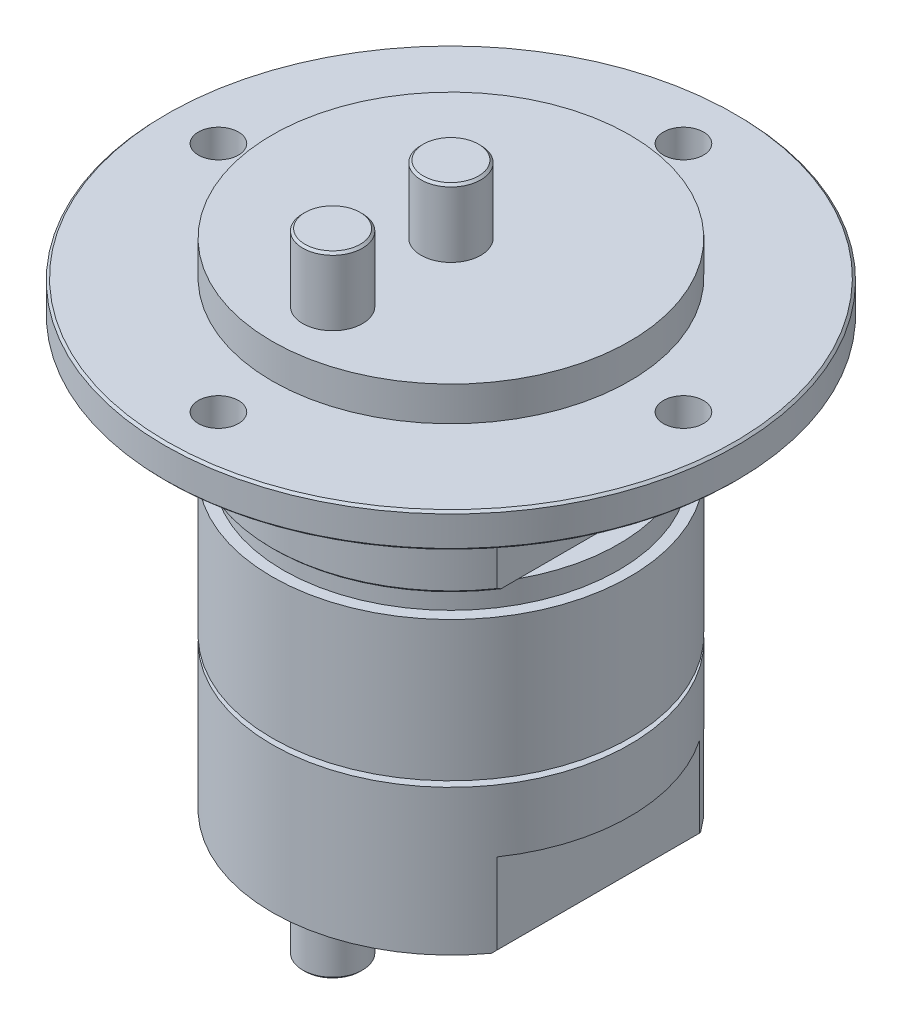
from build123d import *

# Parameters (mm, degrees)
BOSS_EXTRUDE1_DEPTH      = 6
BOSS_EXTRUDE1_DEPTH_BACK = 49.9
SKETCH2_R                = 2.65
SKETCH3_R                = 1.78
CUT_EXTRUDE1_DEPTH       = 6
SKETCH4_W                = 5.711822604
SKETCH4_H                = 7.4
CUT_EXTRUDE2_DEPTH       = 60.035942442
CHAMFER1_SIZE            = 0.2


with BuildPart() as part:
    # Sketch1 → Revolve1 (revolve)
    with BuildSketch(Plane.XY, mode=Mode.PRIVATE) as revolve1_sk:
        Polygon((0, 3.05), (-15.875, 3.05), (-15.875, 0), (-25.4, 0), (-25.4, -3.05), (-15.875, -3.05), (-15.875, -13.05), (-14.875, -13.05), (-14.875, -15.05), (-15.875, -15.05), (-15.875, -27.45), (-14.875, -27.45), (-14.875, -27.95), (-15.875, -27.95), (-15.875, -40.85), (0, -40.85), align=None)
    revolve(revolve1_sk.sketch.rotate(Axis((0, 50.719281348, 0), (0, -1, 0)), 270), axis=Axis((0, 50.719281348, 0), (0, -1, 0)))

    # Sketch2 → Boss-Extrude1 (add, two sides: drawn at the far end of the back side and taken through both)
    with BuildSketch(Plane(origin=(0, 3.05, 0), x_dir=(1, 0, 0), z_dir=(0, 1, 0)).offset(-BOSS_EXTRUDE1_DEPTH_BACK)):
        with Locations(Location((0, 0, 0), (0, 0, 270))):
            Circle(SKETCH2_R)
        with Locations(Location((0, -10.5, 0), (0, 0, 270))):
            Circle(SKETCH2_R)
    extrude(amount=BOSS_EXTRUDE1_DEPTH + BOSS_EXTRUDE1_DEPTH_BACK)

    # Sketch3 → Cut-Extrude1 (cut)
    with BuildSketch(Plane(origin=(0, 0, 0), x_dir=(1, 0, 0), z_dir=(0, 1, 0))):
        with Locations(Location((0, 20.64, 0), (0, 0, 270))):
            Circle(SKETCH3_R)
        with Locations(Location((-20.64, 0, 0), (0, 0, 270))):
            Circle(SKETCH3_R)
        with Locations(Location((0, -20.64, 0), (0, 0, 270))):
            Circle(SKETCH3_R)
        with Locations(Location((20.64, 0, 0), (0, 0, 270))):
            Circle(SKETCH3_R)
    extrude(amount=-CUT_EXTRUDE1_DEPTH, mode=Mode.SUBTRACT)

    # Sketch4 → Cut-Extrude2 (cut, symmetric)
    with BuildSketch(Plane.XY):
        with Locations((-15.935911302, -9.35)):
            Rectangle(SKETCH4_W, SKETCH4_H)
        with Locations((-15.935911302, -37.184964336)):
            Rectangle(SKETCH4_W, SKETCH4_H)
    cut_extrude2 = extrude(amount=CUT_EXTRUDE2_DEPTH, both=True, mode=Mode.SUBTRACT)

    # Mirror1: Cut-Extrude2 across plane
    add(cut_extrude2.mirror(Plane(origin=(0, 0, 0), x_dir=(0, 0, 1), z_dir=(1, 0, 0))), mode=Mode.SUBTRACT)

    # Chamfer1
    chamfer1_edges = [part.edges().sort_by_distance(p)[0] for p in [
        (13.08, -40.85, 0),
        (0, -13.05, -15.875),
        (0, -3.05, -25.4),
        (0, 0, -25.4),
        (0, -46.85, -2.65),
        (0, 9.05, -2.65),
        (0, -46.85, 7.85),
        (0, 9.05, 7.85),
        (-13.08, -40.85, 0),
        (-7.389284751, -13.05, 14.050412658),
    ]]
    chamfer(chamfer1_edges, length=CHAMFER1_SIZE)


solid = part.part
